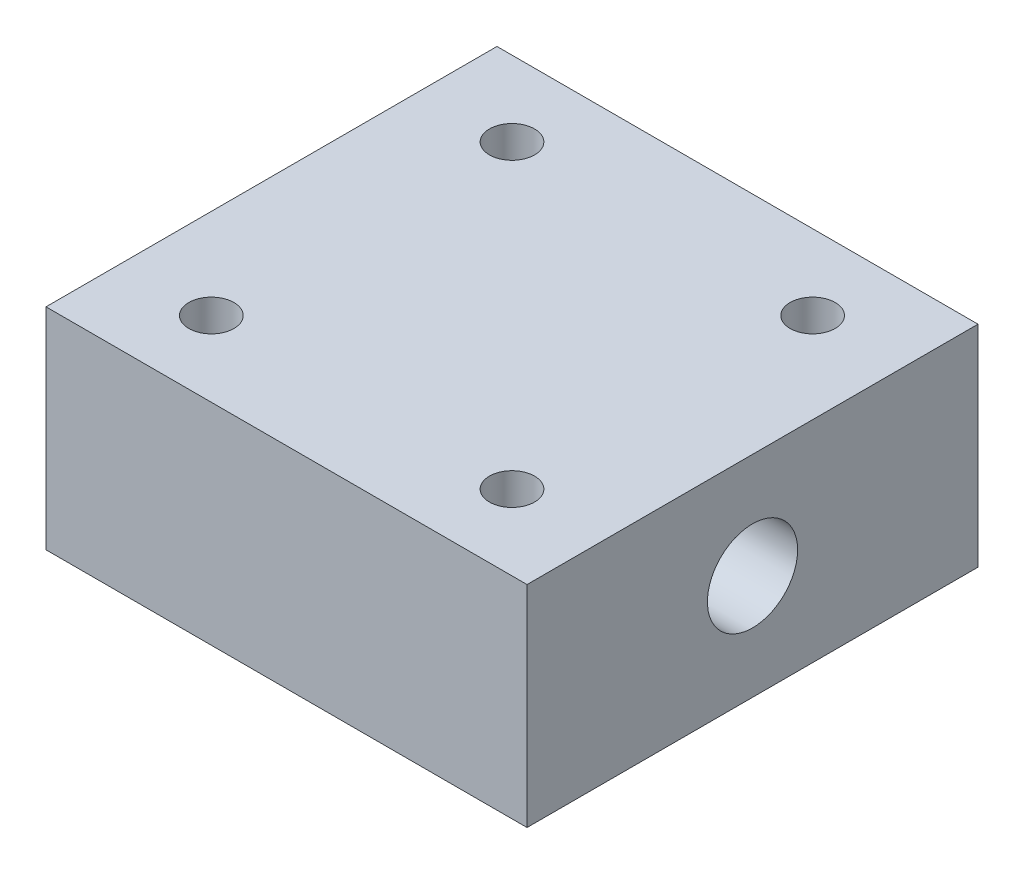
from build123d import *

# Parameters (mm, degrees)
SKETCH_1_W          = 32
SKETCH_1_H          = 14
EXTRUDE_1_DEPTH     = 30
SKETCH_2_R          = 1.5
CUT_EXTRUDE_1_DEPTH = 10
CUT_EXTRUDE_2_REACH = 46.418
SKETCH_3_R          = 3


with BuildPart() as part:
    # 草图1 → 凸台-拉伸1 (new body)
    with BuildSketch(Plane.XY):
        Rectangle(SKETCH_1_W, SKETCH_1_H)
    extrude(amount=-EXTRUDE_1_DEPTH)

    # 草图2 → 切除-拉伸1 (cut)
    with BuildSketch(Plane(origin=(0, 7, 0), x_dir=(1, 0, 0), z_dir=(0, 1, 0))):
        with Locations(Location((-10, 25, 0), (0, 0, 270))):
            Circle(SKETCH_2_R)
        with Locations(Location((10, 25, 0), (0, 0, 90))):
            Circle(SKETCH_2_R)
        with Locations(Location((10, 5, 0), (0, 0, 270))):
            Circle(SKETCH_2_R)
        with Locations(Location((-10, 5, 0), (0, 0, 90))):
            Circle(SKETCH_2_R)
    extrude(amount=-CUT_EXTRUDE_1_DEPTH, mode=Mode.SUBTRACT)

    # 草图3 → 切除-拉伸2 (cut, up to next)
    with BuildSketch(Plane(origin=(16, 0, 0), x_dir=(0, 0, -1), z_dir=(1, 0, 0)), mode=Mode.PRIVATE) as cut_extrude_2_sk1:
        with Locations((15, 0)):
            Circle(SKETCH_3_R)
    cut_extrude_2_tool1 = extrude(cut_extrude_2_sk1.sketch, amount=-CUT_EXTRUDE_2_REACH, mode=Mode.PRIVATE) & part.part
    add(cut_extrude_2_tool1.solids().sort_by_distance((16, 0, -15))[0], mode=Mode.SUBTRACT)


solid = part.part
